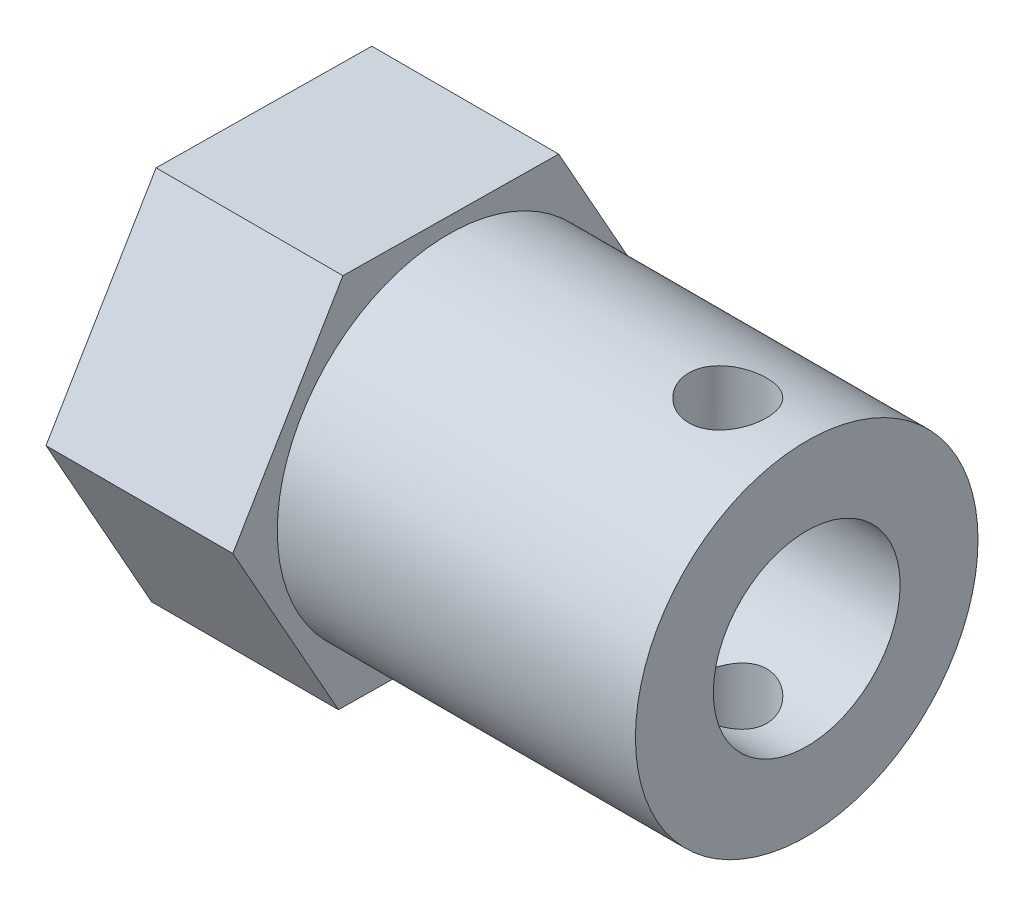
from build123d import *

# Parameters (mm, degrees)
SKETCH1_R           = 5.5
BOSS_EXTRUDE1_DEPTH = 11.5
BOSS_EXTRUDE2_DEPTH = 6
SKETCH3_R           = 3
CUT_EXTRUDE1_DEPTH  = 10
SKETCH4_R           = 1.25
CUT_EXTRUDE4_DEPTH  = 10
SKETCH5_R           = 1.5
CUT_EXTRUDE5_DEPTH  = 5


with BuildPart() as part:
    # Sketch1 → Boss-Extrude1 (new body)
    with BuildSketch(Plane(origin=(0, 0, 0), x_dir=(0, 0, -1), z_dir=(1, 0, 0))):
        Circle(SKETCH1_R)
    extrude(amount=BOSS_EXTRUDE1_DEPTH)

    # Sketch2 → Boss-Extrude2 (add)
    with BuildSketch(Plane.ZY):
        Polygon((3.392309556, 6.040880389), (-3.535401101, 5.958266447), (-6.927710656, -0.082613942), (-3.392309556, -6.040880389), (3.535401101, -5.958266447), (6.927710656, 0.082613942), align=None)
    extrude(amount=BOSS_EXTRUDE2_DEPTH)

    # Sketch3 → Cut-Extrude1 (cut)
    with BuildSketch(Plane(origin=(11.5, 0, 0), x_dir=(0, 0, -1), z_dir=(1, 0, 0))):
        Circle(SKETCH3_R)
    extrude(amount=-CUT_EXTRUDE1_DEPTH, mode=Mode.SUBTRACT)

    # Sketch4 → Cut-Extrude4 (cut, symmetric)
    with BuildSketch(Plane(origin=(0, 0, 0), x_dir=(1, 0, 0), z_dir=(0, 1, 0))):
        with Locations(Location((8.965402785, 0, 0), (0, 0, 270))):
            Circle(SKETCH4_R)
    extrude(amount=CUT_EXTRUDE4_DEPTH, both=True, mode=Mode.SUBTRACT)

    # Sketch5 → Cut-Extrude5 (cut)
    with BuildSketch(Plane.ZY.offset(6)):
        Circle(SKETCH5_R)
    extrude(amount=-CUT_EXTRUDE5_DEPTH, mode=Mode.SUBTRACT)


solid = part.part
